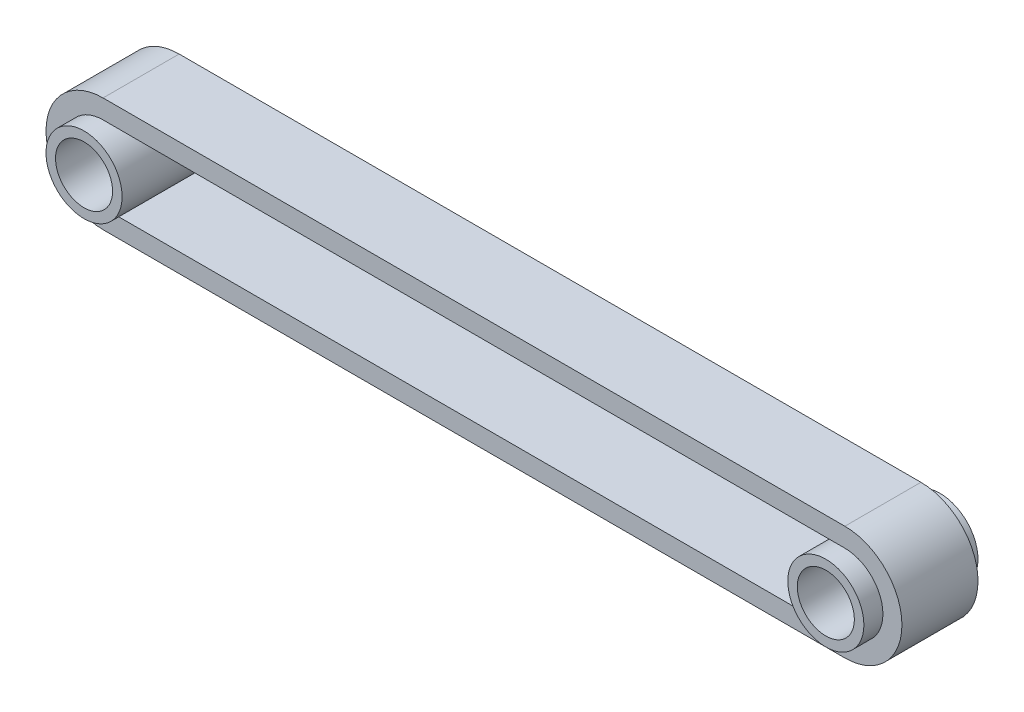
from build123d import *

# Parameters (mm, degrees)
SKETCH1_R             = 20
SKETCH1_R_2           = 15
BOSS_EXTRUDE1_DEPTH   = 60
BOSS_EXTRUDE1_2_DEPTH = 60
BOSS_EXTRUDE2_START   = -50
BOSS_EXTRUDE2_DEPTH   = 40


with BuildPart() as part:
    # Sketch1 → Boss-Extrude1 (new body)
    with BuildSketch(Plane.XY):
        Circle(SKETCH1_R)
        Circle(SKETCH1_R_2, mode=Mode.SUBTRACT)
    extrude(amount=BOSS_EXTRUDE1_DEPTH)



with BuildPart() as body_2:
    # Sketch1 → Boss-Extrude1 2 (new body)
    with BuildSketch(Plane.XY):
        with Locations((390, 0)):
            Circle(SKETCH1_R)
        with Locations((390, 0)):
            Circle(SKETCH1_R_2, mode=Mode.SUBTRACT)
    extrude(amount=BOSS_EXTRUDE1_2_DEPTH)


with BuildPart() as part_1:
    add(part.part)

    add(body_2.part)  # Boss-Extrude2 merges body 2
    # Sketch2 → Boss-Extrude2 (add)
    with BuildSketch(Plane.XY.offset(60).offset(BOSS_EXTRUDE2_START)):
        with BuildLine():
            Line((0, -30), (390, -30))
            ThreePointArc((390, -30), (420, 0), (390, 30))
            Line((390, 30), (0, 30))
            ThreePointArc((0, 30), (-30, 0), (0, -30))
        make_face()
        with BuildLine():
            Line((0, 20), (390, 20))
            ThreePointArc((390, 20), (410, 0), (390, -20))
            Line((390, -20), (0, -20))
            ThreePointArc((0, -20), (-20, 0), (0, 20))
        make_face(mode=Mode.SUBTRACT)
    extrude(amount=BOSS_EXTRUDE2_DEPTH)


solid = part_1.part
